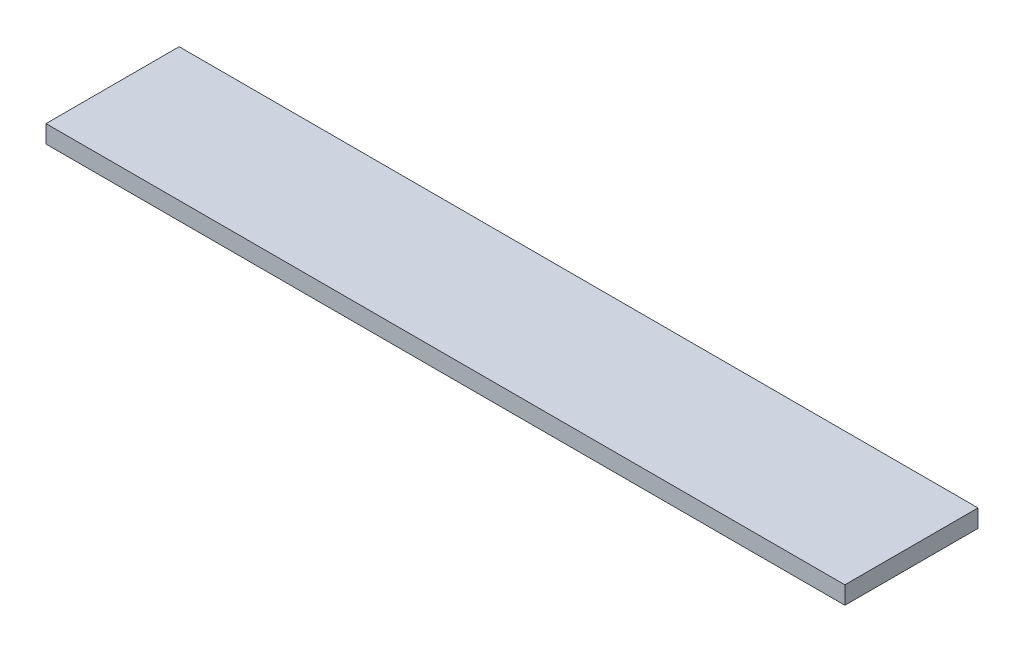
from build123d import *

# Parameters (mm, degrees)
SKETCH1_W           = 15
SKETCH1_H           = 2
BOSS_EXTRUDE1_DEPTH = 90


with BuildPart() as part:
    # Sketch1 → Boss-Extrude1 (new body)
    with BuildSketch(Plane(origin=(0, 0, 0), x_dir=(0, 0, -1), z_dir=(1, 0, 0))):
        Rectangle(SKETCH1_W, SKETCH1_H)
    extrude(amount=BOSS_EXTRUDE1_DEPTH)


solid = part.part
